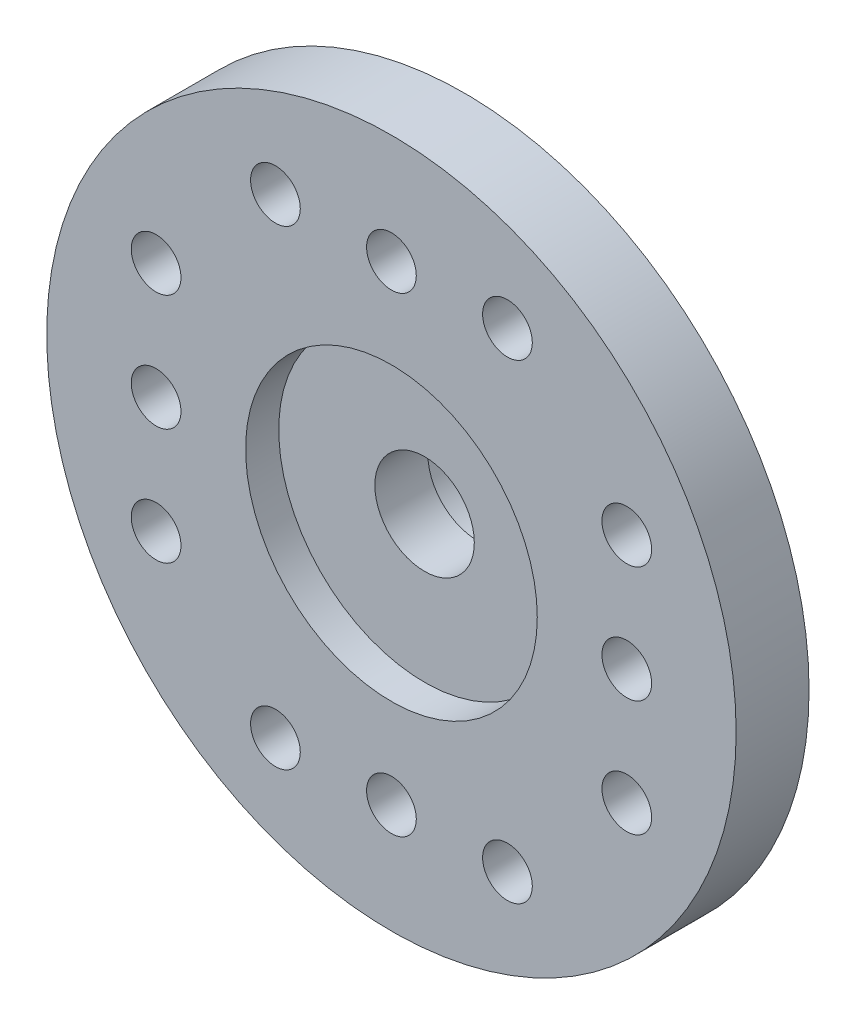
from build123d import *

# Parameters (mm, degrees)
SKETCH_1_R          = 10.4
EXTRUDE_1_DEPTH     = 2.2
SKETCH_2_R          = 4.35
EXTRUDE_2_DEPTH     = 3.3
CUT_EXTRUDE_START   = 3.3
SKETCH_3_R          = 1.5
CUT_EXTRUDE_1_DEPTH = 19.373486657
SKETCH_4_R          = 4.4
CUT_EXTRUDE_2_DEPTH = 1
SKETCH_5_R          = 0.75
CUT_EXTRUDE_3_DEPTH = 16.702547564
SKETCH_6_R          = 2
CUT_EXTRUDE_4_DEPTH = 2.9


with BuildPart() as part:
    # 草图1 → 凸台-拉伸1 (new body)
    with BuildSketch(Plane.XY):
        Circle(SKETCH_1_R)
    extrude(amount=EXTRUDE_1_DEPTH)

    # 草图2 → 凸台-拉伸2 (add)
    with BuildSketch(Plane(origin=(0, 0, 0), x_dir=(-1, 0, 0), z_dir=(0, 0, -1))):
        Circle(SKETCH_2_R)
    extrude(amount=EXTRUDE_2_DEPTH)

    # 草图3 → 切除-拉伸1 (cut, through all)
    with BuildSketch(Plane(origin=(0, 0, 0), x_dir=(-1, 0, 0), z_dir=(0, 0, -1)).offset(CUT_EXTRUDE_START)):
        Circle(SKETCH_3_R)
    extrude(amount=-CUT_EXTRUDE_1_DEPTH, mode=Mode.SUBTRACT)

    # 草图4 → 切除-拉伸2 (cut)
    with BuildSketch(Plane.XY.offset(2.2)):
        Circle(SKETCH_4_R)
    extrude(amount=-CUT_EXTRUDE_2_DEPTH, mode=Mode.SUBTRACT)

    # 草图5 → 切除-拉伸3 (cut, through all)
    with BuildSketch(Plane.XY.offset(2.2)):
        with Locations((0, 7.1)):
            Circle(SKETCH_5_R)
        with Locations((3.5, 7.1)):
            Circle(SKETCH_5_R)
        with Locations((-3.5, 7.1)):
            Circle(SKETCH_5_R)
        with Locations((7.1, 3.5)):
            Circle(SKETCH_5_R)
        with Locations((7.1, 0)):
            Circle(SKETCH_5_R)
        with Locations((7.1, -3.5)):
            Circle(SKETCH_5_R)
        with Locations((3.5, -7.1)):
            Circle(SKETCH_5_R)
        with Locations((0, -7.1)):
            Circle(SKETCH_5_R)
        with Locations((-3.5, -7.1)):
            Circle(SKETCH_5_R)
        with Locations((-7.1, -3.5)):
            Circle(SKETCH_5_R)
        with Locations((-7.1, 0)):
            Circle(SKETCH_5_R)
        with Locations((-7.1, 3.5)):
            Circle(SKETCH_5_R)
    extrude(amount=-CUT_EXTRUDE_3_DEPTH, mode=Mode.SUBTRACT)

    # 草图6 → 切除-拉伸4 (cut)
    with BuildSketch(Plane(origin=(0, 0, -3.3), x_dir=(-1, 0, 0), z_dir=(0, 0, -1))):
        Circle(SKETCH_6_R)
    extrude(amount=-CUT_EXTRUDE_4_DEPTH, mode=Mode.SUBTRACT)


solid = part.part
